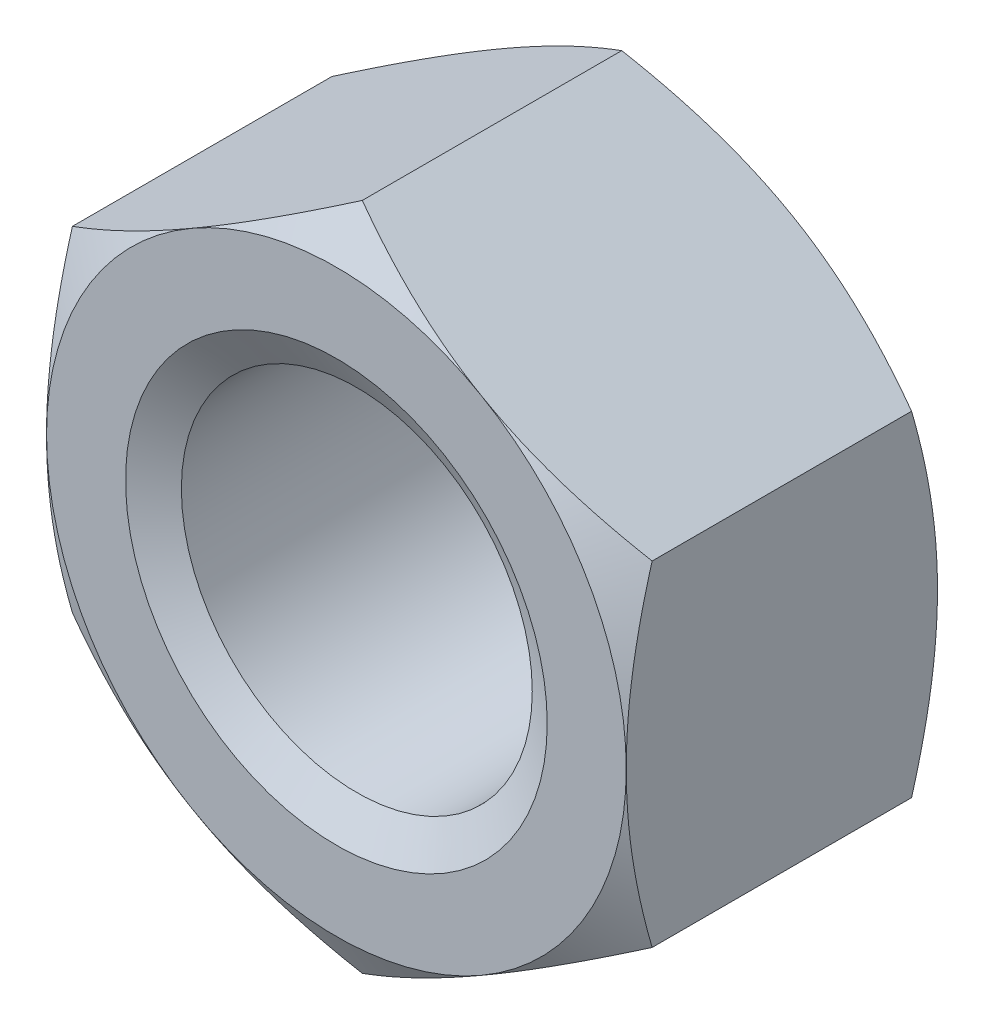
from build123d import *

# Parameters (mm, degrees)
SKETCH_3_R          = 28.7525
EXTRUDE_1_DEPTH     = 51
SKETCH_5_R          = 78.645
SKETCH_5_R_2        = 47.5
CUT_EXTRUDE_1_DEPTH = 10.2
CUT_EXTRUDE_1_DRAFT = -60
SKETCH_7_R          = 78.645
SKETCH_7_R_2        = 47.5
CUT_EXTRUDE_2_DEPTH = 10.2
CUT_EXTRUDE_2_DRAFT = -60


with BuildPart() as part:
    # 草图3 → 凸台-拉伸1 (new body)
    with BuildSketch(Plane.XY):
        Polygon((0, 54.848275573), (-47.5, 27.424137787), (-47.5, -27.424137787), (0, -54.848275573), (47.5, -27.424137787), (47.5, 27.424137787), align=None)
        Circle(SKETCH_3_R, mode=Mode.SUBTRACT)
    extrude(amount=-EXTRUDE_1_DEPTH)

    # 草图4 → 切除-旋转1 (revolve, cut)
    with BuildSketch(Plane(origin=(0, 0, 0), x_dir=(0, 0, -1), z_dir=(1, 0, 0)), mode=Mode.PRIVATE) as cut_revolve_1_sk:
        Polygon((0, 34.55), (3.347188186, 28.7525), (3.347188186, 0), (0, 0), align=None)
        Polygon((51, 0), (51, 34.55), (47.652811814, 28.7525), (47.652811814, 0), align=None)
    revolve(cut_revolve_1_sk.sketch.rotate(Axis((0, 0, 0), (0, 0, -1)), 90), axis=Axis((0, 0, 0), (0, 0, -1)), mode=Mode.SUBTRACT)


with BuildPart() as cut_extrude_1_tool:
    # 草图5 → 切除-拉伸1 (with draft: the straight prism first)
    with BuildSketch(Plane.XY):
        Circle(SKETCH_5_R)
        Circle(SKETCH_5_R_2, mode=Mode.SUBTRACT)
    extrude(amount=-CUT_EXTRUDE_1_DEPTH)
    # 切除-拉伸1: the draft: its side faces are tilted about the plane it starts from
    cut_extrude_1_sides = [cut_extrude_1_tool.faces().sort_by_distance(p)[0] for p in [
        (-78.645, 0, -5.1),
        (-47.5, 0, -5.1),
    ]]
    draft(cut_extrude_1_sides, Plane.XY, CUT_EXTRUDE_1_DRAFT)


with BuildPart() as part_1:
    add(part.part)

    # 切除-拉伸1: cut by cut_extrude_1_tool
    add(cut_extrude_1_tool.part, mode=Mode.SUBTRACT)


with BuildPart() as cut_extrude_2_tool:
    # 草图7 → 切除-拉伸2 (with draft: the straight prism first)
    with BuildSketch(Plane(origin=(0, 0, -51), x_dir=(-1, 0, 0), z_dir=(0, 0, -1))):
        Circle(SKETCH_7_R)
        Circle(SKETCH_7_R_2, mode=Mode.SUBTRACT)
    extrude(amount=-CUT_EXTRUDE_2_DEPTH)
    # 切除-拉伸2: the draft: its side faces are tilted about the plane it starts from
    cut_extrude_2_sides = [cut_extrude_2_tool.faces().sort_by_distance(p)[0] for p in [
        (78.645, 0, -45.9),
        (47.5, 0, -45.9),
    ]]
    draft(cut_extrude_2_sides, Plane(origin=(0, 0, -51), x_dir=(-1, 0, 0), z_dir=(0, 0, -1)), CUT_EXTRUDE_2_DRAFT)


with BuildPart() as part_2:
    add(part_1.part)

    # 切除-拉伸2: cut by cut_extrude_2_tool
    add(cut_extrude_2_tool.part, mode=Mode.SUBTRACT)


solid = part_2.part
